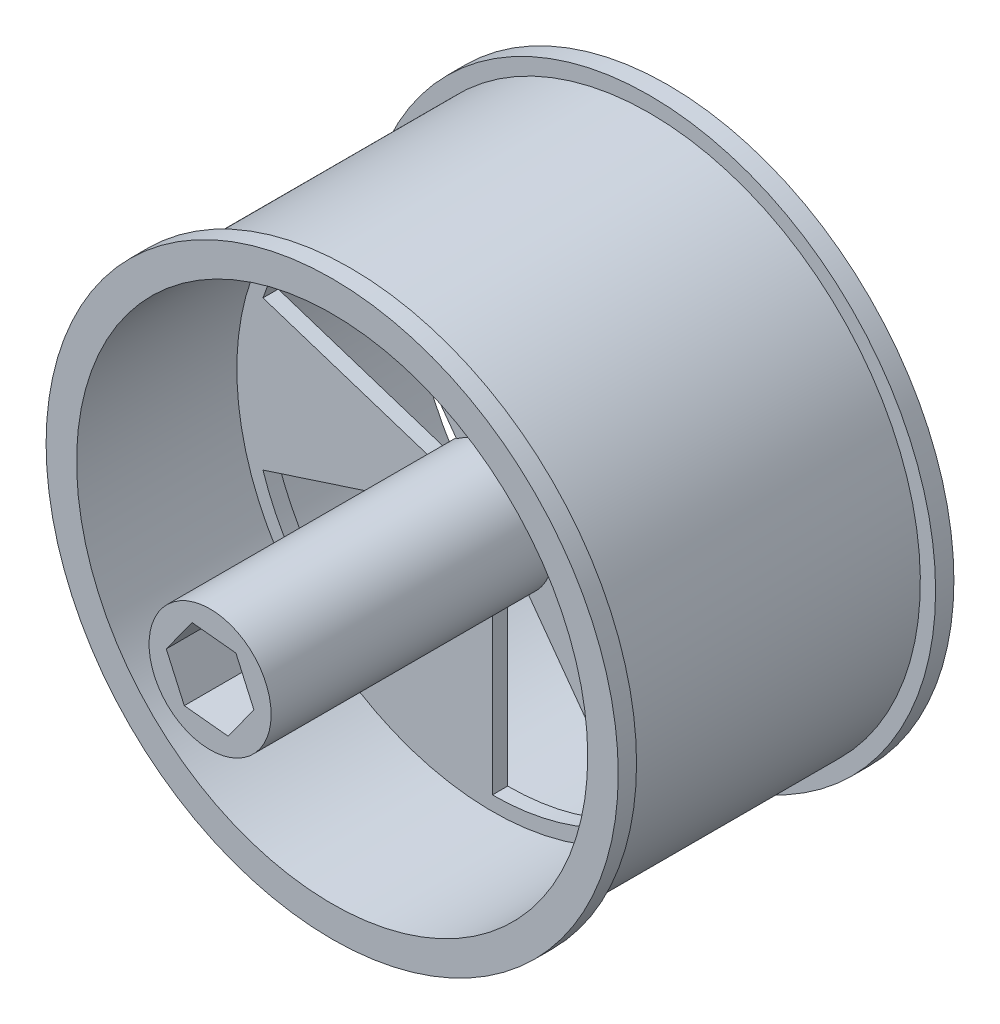
from build123d import *

# Parameters (mm, degrees)
SKETCH1_R               = 23.8125
SKETCH1_R_2             = 21.2725
BOSS_EXTRUDE1_DEPTH     = 27.94
SKETCH2_W               = 24.892
SKETCH2_H               = 1.27
SKETCH5_R               = 21.2725
BOSS_EXTRUDE2_DEPTH     = 0.635
CUT_EXTRUDE2_DEPTH      = 37.706625253
CUT_EXTRUDE2_DEPTH_BACK = 37.706625253
SKETCH7_R               = 5.08
BOSS_EXTRUDE7_DEPTH     = 23.495
CUT_EXTRUDE3_DEPTH      = 19.05


with BuildPart() as part:
    # Sketch1 → Boss-Extrude1 (new body)
    with BuildSketch(Plane.XY):
        Circle(SKETCH1_R)
        Circle(SKETCH1_R_2, mode=Mode.SUBTRACT)
    extrude(amount=BOSS_EXTRUDE1_DEPTH)

    # Sketch2 → Cut-Revolve2 (revolve, cut)
    with BuildSketch(Plane(origin=(0, 0, 0), x_dir=(0, 0, -1), z_dir=(1, 0, 0))):
        with Locations((-13.97, 23.1775)):
            Rectangle(SKETCH2_W, SKETCH2_H)
    revolve(axis=Axis((0, 0, 0), (0, 0, 1)), mode=Mode.SUBTRACT)

    # Sketch5 → Boss-Extrude2 (add, symmetric)
    with BuildSketch(Plane.XY.offset(13.97)):
        Circle(SKETCH5_R)
    extrude(amount=BOSS_EXTRUDE2_DEPTH, both=True)

    # Sketch6 → Cut-Extrude2 (cut, two sides: drawn at the far end of the back side and taken through both)
    with BuildSketch(Plane.XY.offset(14.605).offset(-CUT_EXTRUDE2_DEPTH_BACK)):
        with BuildLine():
            Line((0, 5.08), (0, 20.076289255))
            ThreePointArc((0, 20.076289255), (6.203914564, 19.093685719), (11.800546745, 16.242059191))
            Line((11.800546745, 16.242059191), (2.985949082, 4.109806331))
            ThreePointArc((2.985949082, 4.109806331), (1.569806331, 4.831367103), (0, 5.08))
        make_face()
        with BuildLine():
            Line((4.831367103, 1.569806331), (19.093685719, 6.203914564))
            ThreePointArc((19.093685719, 6.203914564), (20.076289255, 0), (19.093685719, -6.203914564))
            Line((19.093685719, -6.203914564), (4.831367103, -1.569806331))
            ThreePointArc((4.831367103, -1.569806331), (5.08, 0), (4.831367103, 1.569806331))
        make_face()
        with BuildLine():
            Line((2.985949082, -4.109806331), (11.800546745, -16.242059191))
            ThreePointArc((11.800546745, -16.242059191), (6.203914564, -19.093685719), (0, -20.076289255))
            Line((0, -20.076289255), (0, -5.08))
            ThreePointArc((0, -5.08), (1.569806331, -4.831367103), (2.985949082, -4.109806331))
        make_face()
        with BuildLine():
            Line((-2.985949082, -4.109806331), (-11.800546745, -16.242059191))
            ThreePointArc((-11.800546745, -16.242059191), (-16.242059191, -11.800546745), (-19.093685719, -6.203914564))
            Line((-19.093685719, -6.203914564), (-4.831367103, -1.569806331))
            ThreePointArc((-4.831367103, -1.569806331), (-4.109806331, -2.985949082), (-2.985949082, -4.109806331))
        make_face()
        with BuildLine():
            Line((-4.831367103, 1.569806331), (-19.093685719, 6.203914564))
            ThreePointArc((-19.093685719, 6.203914564), (-16.242059191, 11.800546745), (-11.800546745, 16.242059191))
            Line((-11.800546745, 16.242059191), (-2.985949082, 4.109806331))
            ThreePointArc((-2.985949082, 4.109806331), (-4.109806331, 2.985949082), (-4.831367103, 1.569806331))
        make_face()
    extrude(amount=CUT_EXTRUDE2_DEPTH + CUT_EXTRUDE2_DEPTH_BACK, mode=Mode.SUBTRACT)

    # Sketch7 → Boss-Extrude7 (add)
    with BuildSketch(Plane.XY.offset(14.605)):
        Circle(SKETCH7_R)
    extrude(amount=BOSS_EXTRUDE7_DEPTH)

    # Sketch8 → Cut-Extrude3 (cut)
    with BuildSketch(Plane.XY.offset(38.1)):
        Polygon((-1.498265311, 3.346047578), (-3.64689486, 0.375487968), (-2.148629549, -2.97055961), (1.498265311, -3.346047578), (3.64689486, -0.375487968), (2.148629549, 2.97055961), align=None)
    extrude(amount=-CUT_EXTRUDE3_DEPTH, mode=Mode.SUBTRACT)


solid = part.part
